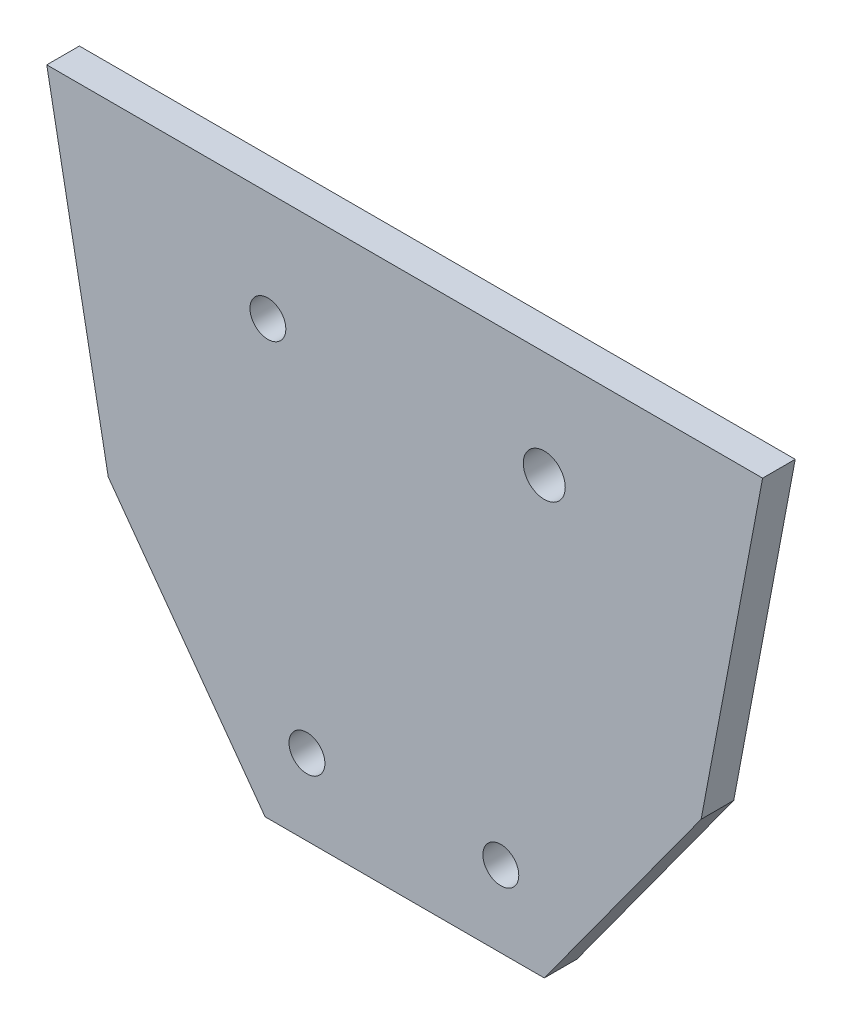
from build123d import *

# Parameters (mm, degrees)
SKETCH2_R           = 1.65
SKETCH2_R_2         = 1.929414359
BOSS_EXTRUDE1_DEPTH = 3


with BuildPart() as part:
    # Sketch2 → Boss-Extrude1 (new body)
    with BuildSketch(Plane.XY):
        Polygon((32.568394145, 0), (-33.272239932, -0.000293688), (-27.618837956, -30), (-13.191429734, -49.85768247), (12.487583947, -49.85768247), (26.91499217, -30), align=None)
        with Locations((-9.342728507, -42.860194395)):
            Circle(SKETCH2_R, mode=Mode.SUBTRACT)
        with Locations((8.490760277, -42.860194395)):
            Circle(SKETCH2_R, mode=Mode.SUBTRACT)
        with Locations((-12.933964176, -10.050384435)):
            Circle(SKETCH2_R, mode=Mode.SUBTRACT)
        with Locations((12.487583947, -9.80768247)):
            Circle(SKETCH2_R_2, mode=Mode.SUBTRACT)
    extrude(amount=BOSS_EXTRUDE1_DEPTH)


solid = part.part
